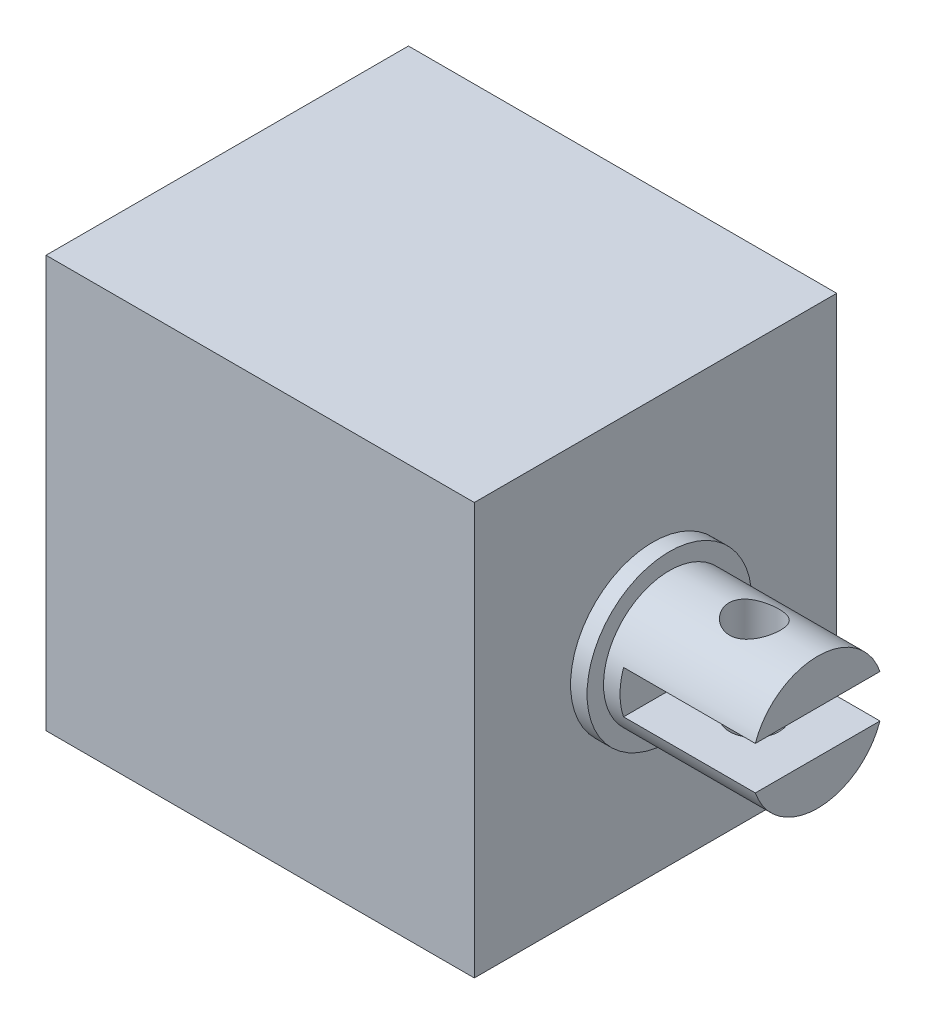
from build123d import *

# Parameters (mm, degrees)
SKETCH3_W           = 26
SKETCH3_H           = 25
BOSS_EXTRUDE2_DEPTH = 22
SKETCH4_R           = 5
BOSS_EXTRUDE3_DEPTH = 1
SKETCH5_R           = 4
BOSS_EXTRUDE4_DEPTH = 9
SKETCH7_W           = 8
SKETCH7_H           = 2.6
CUT_EXTRUDE1_DEPTH  = 5
SKETCH8_R           = 1.5
CUT_EXTRUDE2_DEPTH  = 6


with BuildPart() as part:
    # Sketch3 → Boss-Extrude2 (new body)
    with BuildSketch(Plane.XY):
        Rectangle(SKETCH3_W, SKETCH3_H)
    extrude(amount=BOSS_EXTRUDE2_DEPTH)

    # Sketch4 → Boss-Extrude3 (add)
    with BuildSketch(Plane(origin=(13, 0, 0), x_dir=(0, 0, -1), z_dir=(1, 0, 0))):
        with Locations((-11.15653954, 0)):
            Circle(SKETCH4_R)
    extrude(amount=BOSS_EXTRUDE3_DEPTH)

    # Sketch5 → Boss-Extrude4 (add)
    with BuildSketch(Plane(origin=(14, 0, 0), x_dir=(0, 0, -1), z_dir=(1, 0, 0))):
        with Locations((-11.15653954, 0)):
            Circle(SKETCH5_R)
    extrude(amount=BOSS_EXTRUDE4_DEPTH)

    # Sketch7 → Cut-Extrude1 (cut)
    with BuildSketch(Plane.XY.offset(11)):
        with Locations((19, 0)):
            Rectangle(SKETCH7_W, SKETCH7_H)
    cut_extrude1 = extrude(amount=-CUT_EXTRUDE1_DEPTH, mode=Mode.SUBTRACT)

    # Mirror1: Cut-Extrude1 across plane
    add(cut_extrude1.mirror(Plane.XY.offset(11)), mode=Mode.SUBTRACT)

    # Sketch8 → Cut-Extrude2 (cut)
    with BuildSketch(Plane(origin=(0, 0, 0), x_dir=(1, 0, 0), z_dir=(0, 1, 0))):
        with Locations(Location((19, -11, 0), (0, 0, 270))):
            Circle(SKETCH8_R)
    cut_extrude2 = extrude(amount=-CUT_EXTRUDE2_DEPTH, mode=Mode.SUBTRACT)

    # Mirror2: Cut-Extrude2 across plane
    add(cut_extrude2.mirror(Plane.ZX), mode=Mode.SUBTRACT)


solid = part.part
